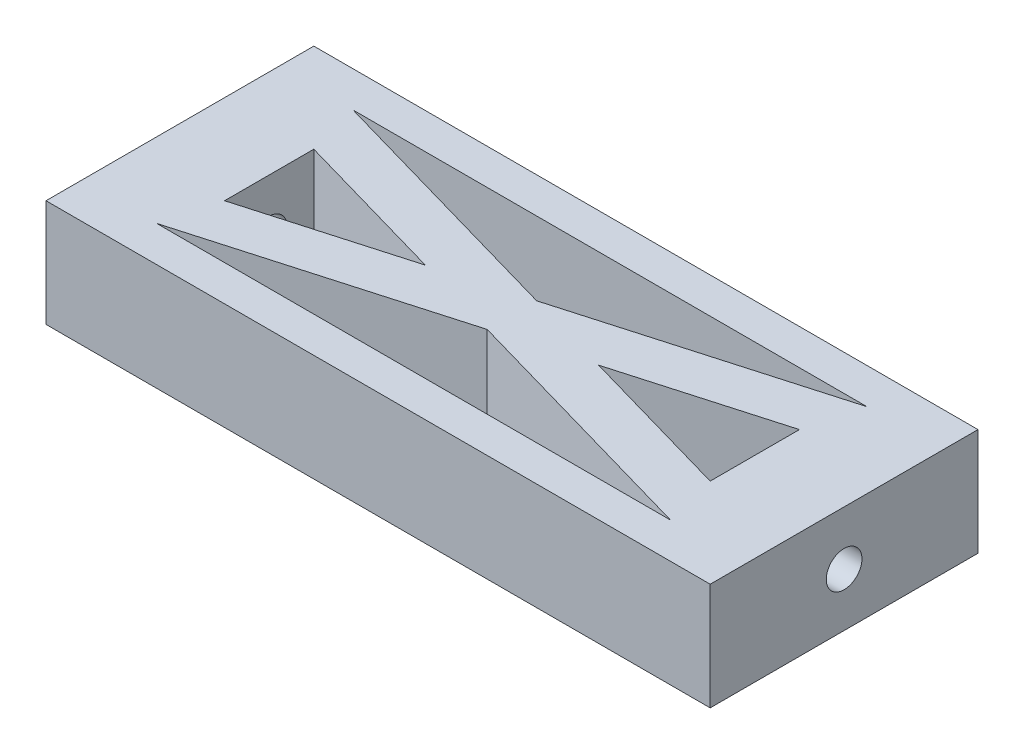
from build123d import *

# Parameters (mm, degrees)
SKETCH1_W           = 47.244
SKETCH1_H           = 19.05
BOSS_EXTRUDE1_DEPTH = 7.62
SKETCH4_R           = 1.27
CUT_EXTRUDE3_DEPTH  = 7.62
SKETCH5_R           = 1.27
CUT_EXTRUDE4_DEPTH  = 7.62
CUT_EXTRUDE8_DEPTH  = 27.585501857


with BuildPart() as part:
    # Sketch1 → Boss-Extrude1 (new body)
    with BuildSketch(Plane(origin=(0, 0, 0), x_dir=(1, 0, 0), z_dir=(0, 1, 0))):
        Rectangle(SKETCH1_W, SKETCH1_H)
    extrude(amount=BOSS_EXTRUDE1_DEPTH)

    # Sketch4 → Cut-Extrude3 (cut)
    with BuildSketch(Plane(origin=(23.622, 0, 0), x_dir=(0, 0, -1), z_dir=(1, 0, 0))):
        with Locations((0, 3.786925891)):
            Circle(SKETCH4_R)
    extrude(amount=-CUT_EXTRUDE3_DEPTH, mode=Mode.SUBTRACT)

    # Sketch5 → Cut-Extrude4 (cut)
    with BuildSketch(Plane.ZY.offset(23.622)):
        with Locations((0, 3.81)):
            Circle(SKETCH5_R)
    extrude(amount=-CUT_EXTRUDE4_DEPTH, mode=Mode.SUBTRACT)

    # Sketch2 → Cut-Extrude8 (cut, through all)
    with BuildSketch(Plane(origin=(0, 7.62, 0), x_dir=(1, 0, 0), z_dir=(0, 1, 0))):
        Polygon((-17.272, 3.175), (-17.272, -3.175), (-6.166997771, 0), align=None)
        Polygon((17.272, 3.175), (6.1595, 0), (17.272, -3.175), align=None)
        Polygon((-17.272, 6.985), (-17.272, 6.694714286), (-0.005828805, 1.761522516), (17.272, 6.701378026), (17.272, 6.985), align=None)
        Polygon((-0.005828805, -1.761522516), (-17.272, -6.694714286), (-17.272, -6.985), (17.272, -6.985), (17.272, -6.701378026), align=None)
        Polygon((18.264007134, -6.985), (17.272, -6.701378026), (17.272, -6.985), align=None)
        Polygon((-17.272, -6.985), (-17.272, -6.694714286), (-18.288, -6.985), align=None)
        Polygon((-18.288, 6.985), (-17.272, 6.694714286), (-17.272, 6.985), align=None)
        Polygon((17.272, 6.985), (17.272, 6.701378026), (18.264007134, 6.985), align=None)
    extrude(amount=-CUT_EXTRUDE8_DEPTH, mode=Mode.SUBTRACT)


solid = part.part
